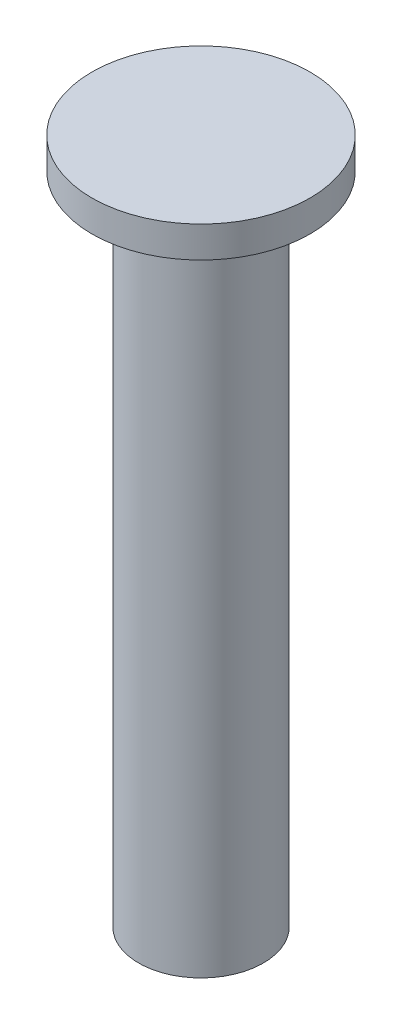
from build123d import *

# Parameters (mm, degrees)
SKETCH1_R           = 2
BOSS_EXTRUDE1_DEPTH = 21
SKETCH2_R           = 3.5
BOSS_EXTRUDE2_DEPTH = 1


with BuildPart() as part:
    # Sketch1 → Boss-Extrude1 (new body)
    with BuildSketch(Plane(origin=(0, 0, 0), x_dir=(1, 0, 0), z_dir=(0, 1, 0))):
        with Locations(Location((0, 0, 0), (0, 0, 90))):
            Circle(SKETCH1_R)
    extrude(amount=BOSS_EXTRUDE1_DEPTH)

    # Sketch2 → Boss-Extrude2 (add)
    with BuildSketch(Plane(origin=(0, 21, 0), x_dir=(1, 0, 0), z_dir=(0, 1, 0))):
        with Locations(Location((0, 0, 0), (0, 0, 270))):
            Circle(SKETCH2_R)
    extrude(amount=BOSS_EXTRUDE2_DEPTH)


solid = part.part
